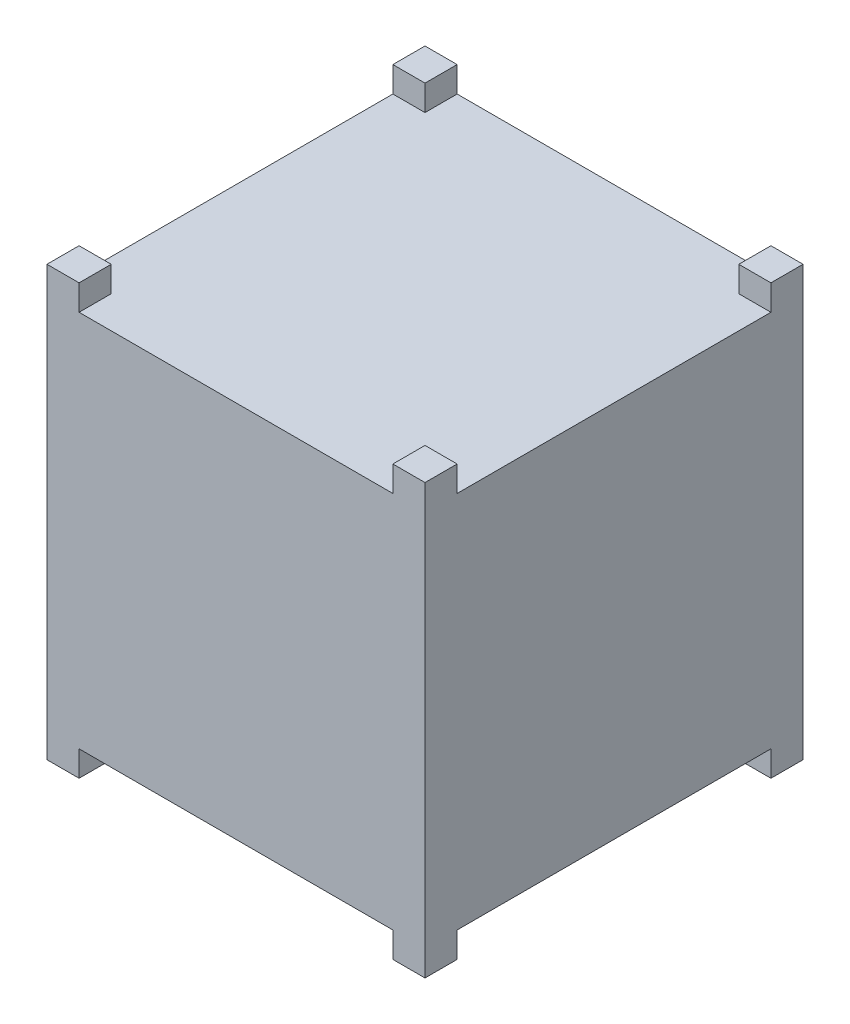
from build123d import *

# Parameters (mm, degrees)
SKETCH1_W           = 100
SKETCH1_H           = 100
BOSS_EXTRUDE1_DEPTH = 113.5
CUT_EXTRUDE1_DEPTH  = 6.75
CUT_EXTRUDE2_START  = -113.5
CUT_EXTRUDE2_DEPTH  = 6.75


with BuildPart() as part:
    # Sketch1 → Boss-Extrude1 (new body)
    with BuildSketch(Plane(origin=(0, 0, 0), x_dir=(1, 0, 0), z_dir=(0, 1, 0))):
        with Locations((50, 50)):
            Rectangle(SKETCH1_W, SKETCH1_H)
    extrude(amount=BOSS_EXTRUDE1_DEPTH)

    # Sketch2 → Cut-Extrude1 (cut)
    with BuildSketch(Plane(origin=(0, 113.5, 0), x_dir=(1, 0, 0), z_dir=(0, 1, 0))):
        Polygon((91.5, 100), (8.5, 100), (8.5, 91.5), (0, 91.5), (0, 8.5), (8.5, 8.5), (8.5, 0), (91.5, 0), (91.5, 8.5), (100, 8.5), (100, 91.5), (91.5, 91.5), align=None)
    extrude(amount=-CUT_EXTRUDE1_DEPTH, mode=Mode.SUBTRACT)

    # Sketch2<3> → Cut-Extrude2 (cut)
    with BuildSketch(Plane(origin=(0, 113.5, 0), x_dir=(1, 0, 0), z_dir=(0, 1, 0)).offset(CUT_EXTRUDE2_START)):
        Polygon((91.5, 100), (8.5, 100), (8.5, 91.5), (0, 91.5), (0, 8.5), (8.5, 8.5), (8.5, 0), (91.5, 0), (91.5, 8.5), (100, 8.5), (100, 91.5), (91.5, 91.5), align=None)
    extrude(amount=CUT_EXTRUDE2_DEPTH, mode=Mode.SUBTRACT)


solid = part.part
